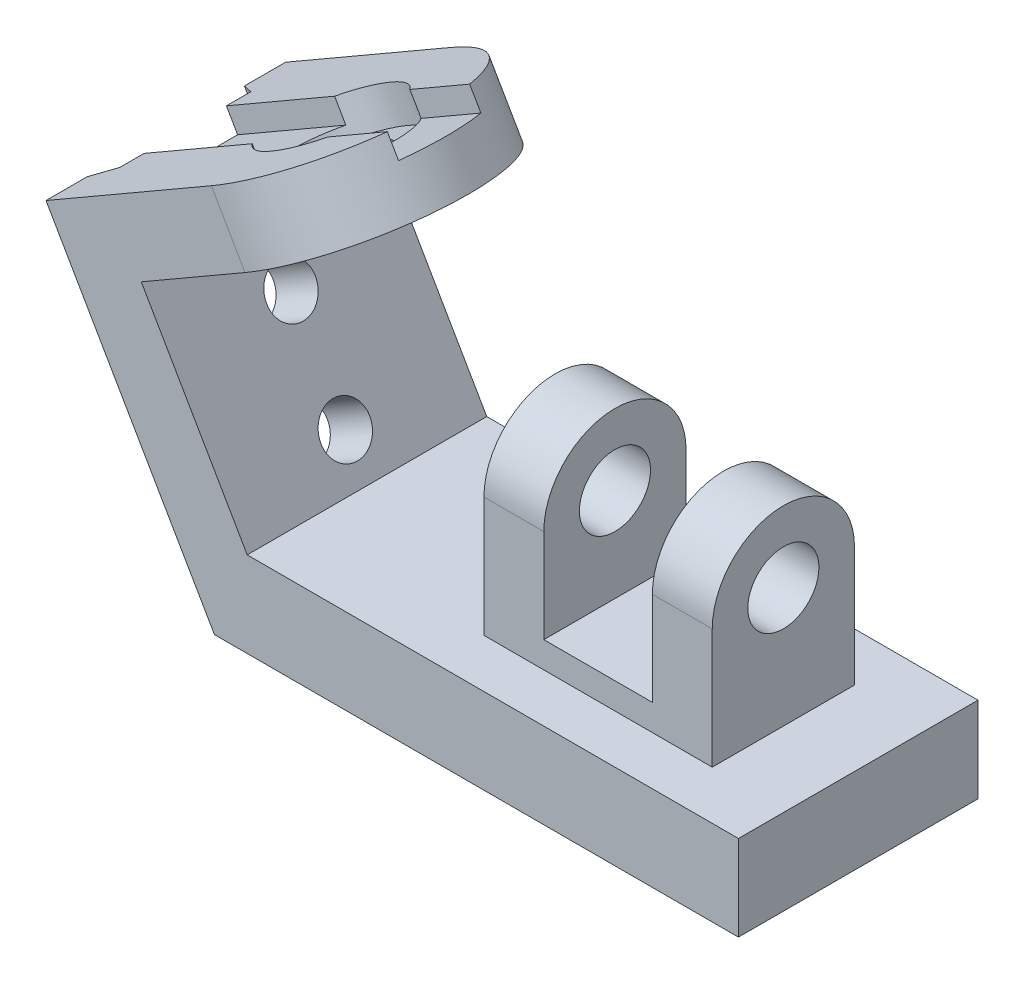
from build123d import *

# Parameters (mm, degrees)
EXTRUDE_1_DEPTH     = 32
EXTRUDE_2_DEPTH     = 18
CUT_EXTRUDE_1_DEPTH = 204.283053893
SKETCH_5_W          = 110.763550328
SKETCH_5_H          = 22
CUT_EXTRUDE_2_DEPTH = 6
SKETCH_6_R          = 9.5
CUT_EXTRUDE_3_DEPTH = 36
SKETCH_6_3_R        = 16
CUT_EXTRUDE_4_DEPTH = 9
SKETCH_7_R          = 6.5
CUT_EXTRUDE_5_DEPTH = 181.357330689
SKETCH_8_W          = 38
SKETCH_8_H          = 7
EXTRUDE_3_DEPTH     = 30.5
EXTRUDE_START       = 14.5
SKETCH_8_3_R        = 9.5
EXTRUDE_4_DEPTH     = 16


with BuildPart() as part:
    # 草圖1 → 填料-伸長1 (new, symmetric)
    with BuildSketch(Plane.XY):
        Polygon((0, 0), (-45, 77.942286341), (-28.545517328, 87.442286341), (8.758035362, 22.830637779), (140, 22.830637779), (140, 0), align=None)
    extrude(amount=EXTRUDE_1_DEPTH, both=True)

    # 草圖2 → 填料-伸長2 (add)
    with BuildSketch(Plane(origin=(-45, 77.942286341, 0), x_dir=(0.8660254037844364, 0.5000000000000041, 0), z_dir=(-0.500000000000004, 0.8660254037844363, 0))):
        with BuildLine():
            Line((19, 32), (19, -32))
            Line((19, -32), (51, -32))
            ThreePointArc((51, -32), (83, 0), (51, 32))
            Line((51, 32), (19, 32))
        make_face()
    extrude(amount=-EXTRUDE_2_DEPTH)

    # 草圖4 → 除料-伸長1 (cut, through all)
    with BuildSketch(Plane(origin=(-45, 77.942286341, 0), x_dir=(0.8660254037844364, 0.5000000000000041, 0), z_dir=(-0.500000000000004, 0.8660254037844363, 0))):
        Polygon((0, 21), (6, 17.535898385), (6, -17.535898385), (0, -21), align=None)
    extrude(amount=-CUT_EXTRUDE_1_DEPTH, mode=Mode.SUBTRACT)

    # 草圖5 → 除料-伸長2 (cut)
    with BuildSketch(Plane(origin=(-45, 77.942286341, 0), x_dir=(0.8660254037844364, 0.5000000000000041, 0), z_dir=(-0.500000000000004, 0.8660254037844363, 0))):
        with Locations((41.909126347, 0)):
            Rectangle(SKETCH_5_W, SKETCH_5_H)
    extrude(amount=-CUT_EXTRUDE_2_DEPTH, mode=Mode.SUBTRACT)

    # 草圖6 → 除料-伸長3 (cut)
    with BuildSketch(Plane(origin=(-45, 77.942286341, 0), x_dir=(0.8660254037844364, 0.5000000000000041, 0), z_dir=(-0.500000000000004, 0.8660254037844363, 0))):
        with Locations((51, 0)):
            Circle(SKETCH_6_R)
    extrude(amount=-CUT_EXTRUDE_3_DEPTH, mode=Mode.SUBTRACT)

    # 草圖6<3> → 除料-伸長4 (cut)
    with BuildSketch(Plane(origin=(-45, 77.942286341, 0), x_dir=(0.8660254037844364, 0.5000000000000041, 0), z_dir=(-0.500000000000004, 0.8660254037844363, 0))):
        with Locations((51, 0)):
            Circle(SKETCH_6_3_R)
    extrude(amount=-CUT_EXTRUDE_4_DEPTH, mode=Mode.SUBTRACT)

    # 草圖7 → 除料-伸長5 (cut, through all)
    with BuildSketch(Plane(origin=(5.196152423, 3, 0), x_dir=(0, 0, 1), z_dir=(-0.8660254037844365, -0.500000000000004, 0))):
        with Locations((0, 56)):
            Circle(SKETCH_7_R)
        with Locations((0, 27)):
            Circle(SKETCH_7_R)
    extrude(amount=-CUT_EXTRUDE_5_DEPTH, mode=Mode.SUBTRACT)

    # 草圖8 → 填料-伸長3 (add, symmetric)
    with BuildSketch(Plane(origin=(89.5, 0, 0), x_dir=(0, 0, -1), z_dir=(1, 0, 0))):
        with Locations((0, 26.330637779)):
            Rectangle(SKETCH_8_W, SKETCH_8_H)
    extrude(amount=EXTRUDE_3_DEPTH, both=True)

    # 草圖8<3> → 填料-伸長4 (add)
    with BuildSketch(Plane(origin=(89.5, 0, 0), x_dir=(0, 0, -1), z_dir=(1, 0, 0)).offset(EXTRUDE_START)):
        with BuildLine():
            Line((-19, 54.830637779), (-19, 29.830637779))
            Line((-19, 29.830637779), (19, 29.830637779))
            Line((19, 29.830637779), (19, 54.830637779))
            ThreePointArc((19, 54.830637779), (0, 73.830637779), (-19, 54.830637779))
        make_face()
        with Locations((0, 54.830637779)):
            Circle(SKETCH_8_3_R, mode=Mode.SUBTRACT)
    extrude_4 = extrude(amount=EXTRUDE_4_DEPTH)

    # 鏡射1: 填料-伸長4 across plane
    add(extrude_4.mirror(Plane(origin=(89.5, 0, 0), x_dir=(0, 0, 1), z_dir=(1, 0, 0))))


solid = part.part
